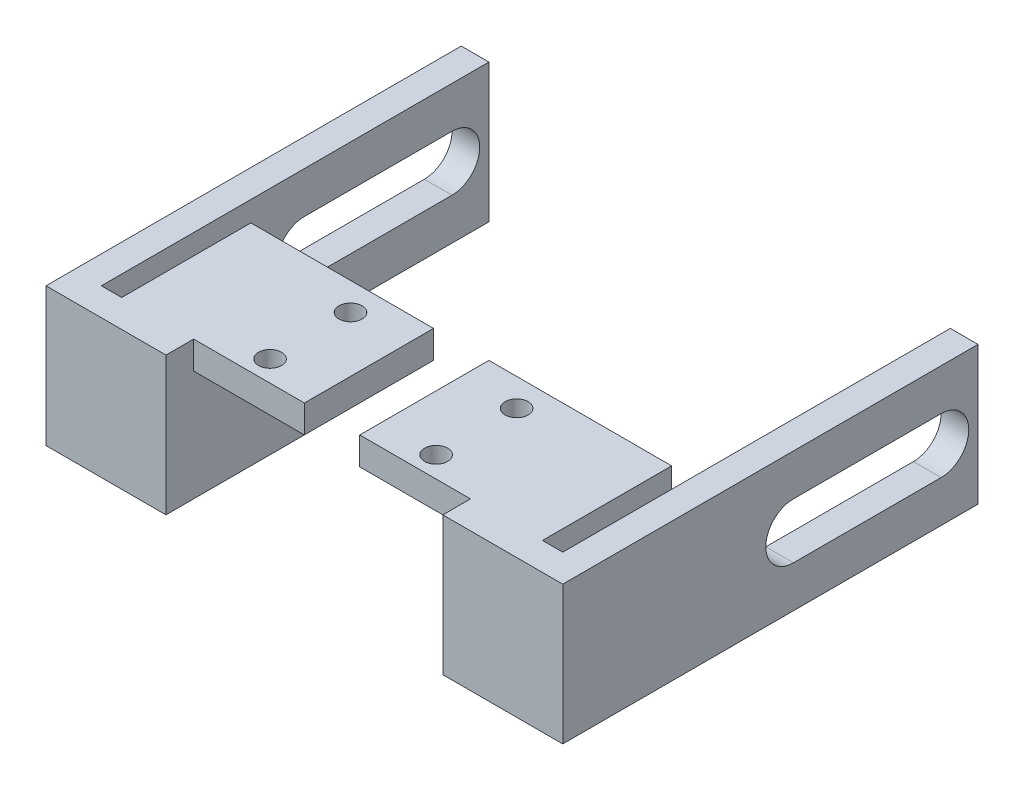
from build123d import *

# Parameters (mm, degrees)
SKETCH1_W                   = 45
SKETCH1_H                   = 15
MOUNTS_TO_CNC_DEPTH         = 3
SKETCH2_W                   = 10
SKETCH2_H                   = 17
WRAP_AROUND_DEPTH           = 15
SPACE_FOR_STEEL_REACH       = 50.477
SKETCH4_W                   = 2.2
SKETCH4_H                   = 42
SKETCH5_W                   = 14
SKETCH5_H                   = 3
LEVEL_SWITCH_PLATFORM_DEPTH = 12
SWITCH_MOUNT_HOLES_REACH    = 54.288
SKETCH7_R                   = 1.25


with BuildPart() as part:
    # Sketch1 → mounts_to_cnc (new body)
    with BuildSketch(Plane(origin=(0, 0, 0), x_dir=(0, 0, -1), z_dir=(1, 0, 0))):
        with Locations((22.5, 7.5)):
            Rectangle(SKETCH1_W, SKETCH1_H)
        with BuildLine():
            Line((41, 4.5), (25, 4.5))
            ThreePointArc((25, 4.5), (22, 7.5), (25, 10.5))
            Line((25, 10.5), (41, 10.5))
            ThreePointArc((41, 10.5), (44, 7.5), (41, 4.5))
        make_face(mode=Mode.SUBTRACT)
    extrude(amount=MOUNTS_TO_CNC_DEPTH)

    # Sketch2 → wrap_around (add)
    with BuildSketch(Plane(origin=(0, 0, 0), x_dir=(1, 0, 0), z_dir=(0, 1, 0))):
        with Locations((-5, 8.5)):
            Rectangle(SKETCH2_W, SKETCH2_H)
    extrude(amount=WRAP_AROUND_DEPTH)

    # Sketch4 → space_for_steel (cut, up to next)
    with BuildSketch(Plane(origin=(0, 15, 0), x_dir=(1, 0, 0), z_dir=(0, 1, 0)), mode=Mode.PRIVATE) as space_for_steel_sk1:
        with Locations((-1.1, 24)):
            Rectangle(SKETCH4_W, SKETCH4_H)
    space_for_steel_tool1 = extrude(space_for_steel_sk1.sketch, amount=-SPACE_FOR_STEEL_REACH, mode=Mode.PRIVATE) & part.part
    add(space_for_steel_tool1.solids().sort_by_distance((-1.1, 15, -24))[0], mode=Mode.SUBTRACT)

    # Sketch5 → level_switch_platform (add)
    with BuildSketch(Plane.ZY.offset(10)):
        with Locations((-10, 13.5)):
            Rectangle(SKETCH5_W, SKETCH5_H)
    extrude(amount=LEVEL_SWITCH_PLATFORM_DEPTH)

    # Sketch7 → switch_mount_holes (cut, up to next)
    with BuildSketch(Plane(origin=(0, 15, 0), x_dir=(1, 0, 0), z_dir=(0, 1, 0)), mode=Mode.PRIVATE) as switch_mount_holes_sk1:
        with Locations(Location((-16, 14, 0), (0, 0, 270))):
            Circle(SKETCH7_R)
    switch_mount_holes_tool1 = extrude(switch_mount_holes_sk1.sketch, amount=-SWITCH_MOUNT_HOLES_REACH, mode=Mode.PRIVATE) & part.part
    # Sketch7 → switch_mount_holes (cut, up to next)
    with BuildSketch(Plane(origin=(0, 15, 0), x_dir=(1, 0, 0), z_dir=(0, 1, 0)), mode=Mode.PRIVATE) as switch_mount_holes_sk2:
        with Locations(Location((-16, 5.28, 0), (0, 0, 270))):
            Circle(SKETCH7_R)
    switch_mount_holes_tool2 = extrude(switch_mount_holes_sk2.sketch, amount=-SWITCH_MOUNT_HOLES_REACH, mode=Mode.PRIVATE) & part.part
    add(switch_mount_holes_tool1.solids().sort_by_distance((-16, 15, -14))[0], mode=Mode.SUBTRACT)
    add(switch_mount_holes_tool2.solids().sort_by_distance((-16, 15, -5.28))[0], mode=Mode.SUBTRACT)


with BuildPart() as body_2:
    # chiarity_copy: mirrored copy
    add(part.part.mirror(Plane.ZY.offset(25)))


solid = Compound([part.part, body_2.part])
